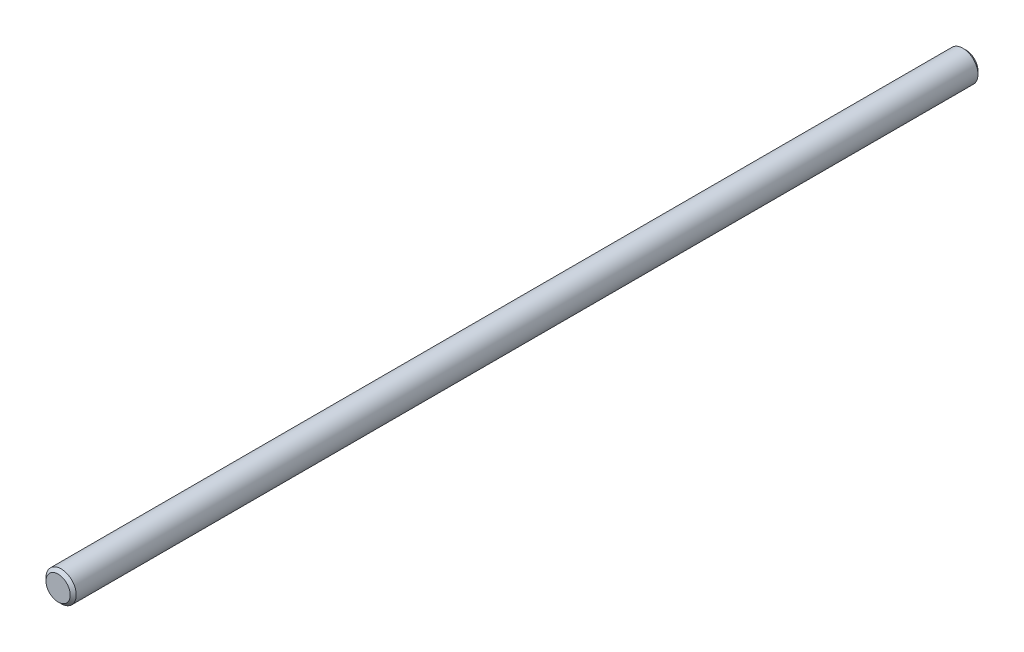
from build123d import *

# Parameters (mm, degrees)
SKETCH1_R      = 10
EXTRUDE1_DEPTH = 300
CHAMFER1_SIZE  = 2


with BuildPart() as part:
    # Sketch1 → Extrude1 (new, symmetric)
    with BuildSketch(Plane.XY):
        Circle(SKETCH1_R)
    extrude(amount=EXTRUDE1_DEPTH, both=True)

    # Chamfer1
    chamfer1_edges = [part.edges().sort_by_distance(p)[0] for p in [
        (-10, 0, -300),
        (-10, 0, 300),
    ]]
    chamfer(chamfer1_edges, length=CHAMFER1_SIZE)


solid = part.part
